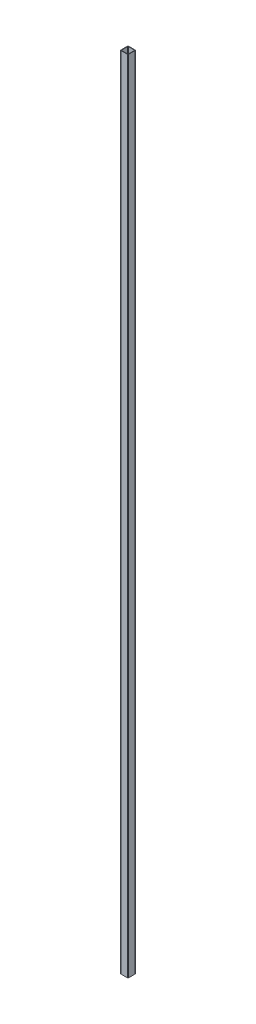
from build123d import *

# Parameters (mm, degrees)
EXTRUDE_1_DEPTH = 4240


with BuildPart() as part:
    # Эскиз1 → Бобышка-Вытянуть1 (new body)
    with BuildSketch(Plane(origin=(0, 0, 0), x_dir=(1, 0, 0), z_dir=(0, 1, 0))):
        with BuildLine():
            Line((18, 20), (-18, 20))
            ThreePointArc((-18, 20), (-19.414213562, 19.414213562), (-20, 18))
            Line((-20, 18), (-20, -18))
            ThreePointArc((-20, -18), (-19.414213562, -19.414213562), (-18, -20))
            Line((-18, -20), (18, -20))
            ThreePointArc((18, -20), (19.414213562, -19.414213562), (20, -18))
            Line((20, -18), (20, 18))
            ThreePointArc((20, 18), (19.414213562, 19.414213562), (18, 20))
        make_face()
        with BuildLine():
            Line((16, 18), (-16, 18))
            ThreePointArc((-16, 18), (-17.414213562, 17.414213562), (-18, 16))
            Line((-18, 16), (-18, -16))
            ThreePointArc((-18, -16), (-17.414213562, -17.414213562), (-16, -18))
            Line((-16, -18), (16, -18))
            ThreePointArc((16, -18), (17.414213562, -17.414213562), (18, -16))
            Line((18, -16), (18, 16))
            ThreePointArc((18, 16), (17.414213562, 17.414213562), (16, 18))
        make_face(mode=Mode.SUBTRACT)
    extrude(amount=EXTRUDE_1_DEPTH)


solid = part.part
